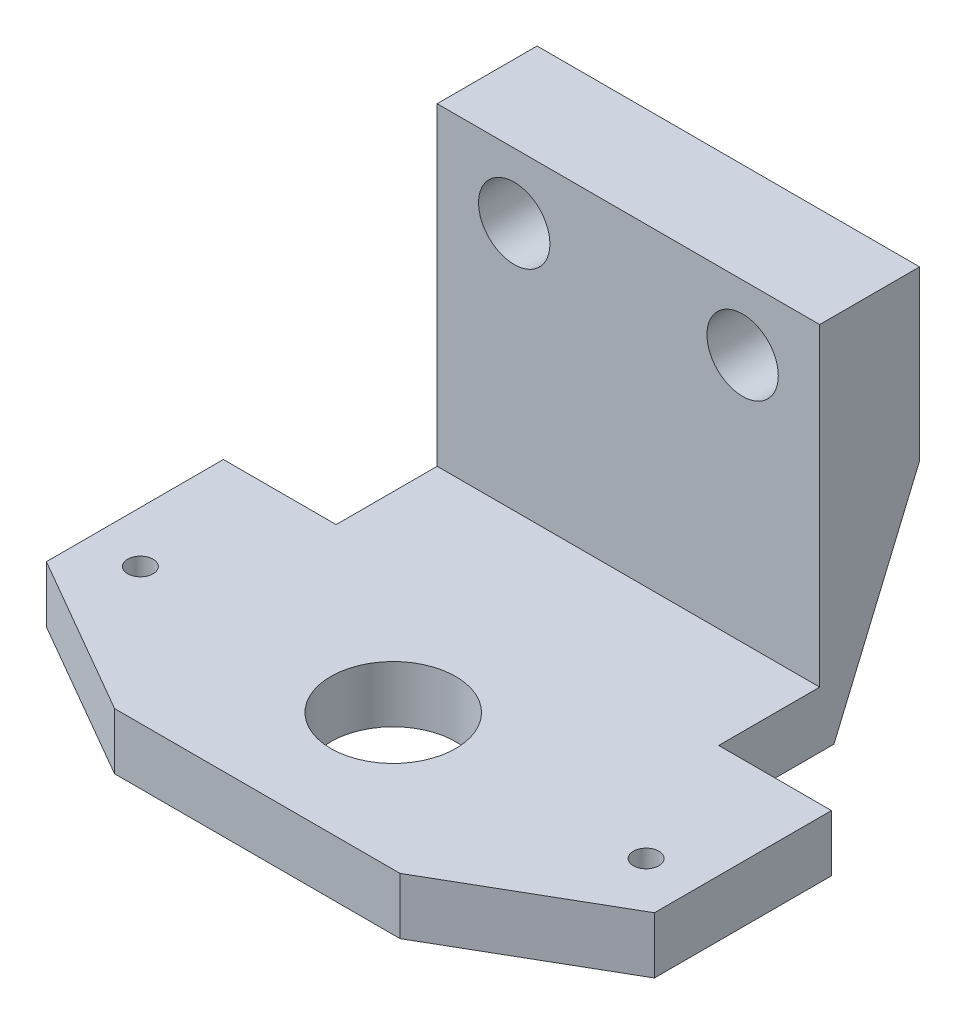
from build123d import *

# Parameters (mm, degrees)
BOSS_EXTRUDE1_DEPTH         = 5.0292
SKETCH2_W                   = 34.036
SKETCH2_H                   = 8.89
BOSS_EXTRUDE2_DEPTH         = 32.9692
CUT_EXTRUDE1_DEPTH          = 61.762903104
CUT_EXTRUDE1_DEPTH_BACK     = 61.762903104
F_1_4_0_25_DIAMETER_HOLE1_D = 6.35
SKETCH7_R                   = 5.55625
CUT_EXTRUDE2_DEPTH          = 47.642102064
F_4_40_TAPPED_HOLE1_D       = 2.2606


with BuildPart() as part:
    # Sketch1 → Boss-Extrude1 (new body)
    with BuildSketch(Plane(origin=(0, 0, 0), x_dir=(1, 0, 0), z_dir=(0, 1, 0))):
        Polygon((-27.051, 7.874), (-17.018, 7.874), (-17.018, 16.860446287), (17.018, 16.860446287), (17.018, 7.874), (27.051, 7.874), (27.051, -7.874), (12.7, -16.159553713), (-12.7, -16.159553713), (-27.051, -7.874), align=None)
    extrude(amount=BOSS_EXTRUDE1_DEPTH)

    # Sketch2 → Boss-Extrude2 (add)
    with BuildSketch(Plane(origin=(0, 0, 0), x_dir=(1, 0, 0), z_dir=(0, 1, 0))):
        with Locations((0, 21.305446287)):
            Rectangle(SKETCH2_W, SKETCH2_H)
    extrude(amount=BOSS_EXTRUDE2_DEPTH)

    # Sketch3 → Cut-Extrude1 (cut, two sides: drawn at the far end of the back side and taken through both)
    with BuildSketch(Plane(origin=(17.018, 0, 0), x_dir=(0, 0, -1), z_dir=(1, 0, 0)).offset(-CUT_EXTRUDE1_DEPTH_BACK)):
        Polygon((66.671605927, 114.880744481), (25.750446287, 18.034), (18.130446287, 0), (-22.790713353, -96.846744481), (170.902775608, -178.68906376), (260.365094888, 33.038425201), align=None)
    extrude(amount=CUT_EXTRUDE1_DEPTH + CUT_EXTRUDE1_DEPTH_BACK, mode=Mode.SUBTRACT)

    # 1/4 (0.25) Diameter Hole1 (through all)
    with Locations(Plane.XY.offset(-16.860446287)):
        with Locations((-10.16, 27.178), (10.16, 27.178)):
            Hole(F_1_4_0_25_DIAMETER_HOLE1_D / 2)

    # Sketch7 → Cut-Extrude2 (cut, through all)
    with BuildSketch(Plane(origin=(0, 5.0292, 0), x_dir=(1, 0, 0), z_dir=(0, 1, 0))):
        with Locations(Location((0, -4.064, 0), (0, 0, 270))):
            Circle(SKETCH7_R)
    extrude(amount=-CUT_EXTRUDE2_DEPTH, mode=Mode.SUBTRACT)

    # #4-40 Tapped Hole1 (through all)
    with Locations(Plane(origin=(0, 5.0292, 0), x_dir=(1, 0, 0), z_dir=(0, 1, 0))):
        with Locations((0, 0), (-22.5, -4.064), (22.5, -4.064)):
            Hole(F_4_40_TAPPED_HOLE1_D / 2)


solid = part.part
